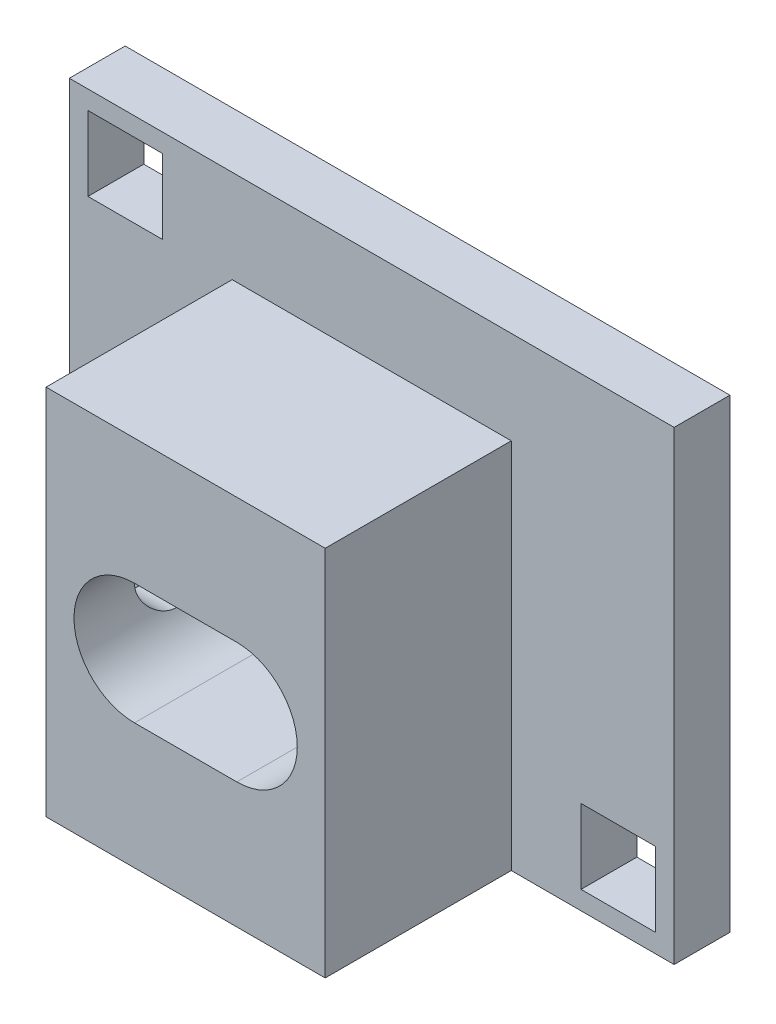
from build123d import *

# Parameters (mm, degrees)
SKETCH_1_W               = 65
SKETCH_1_H               = 50
EXTRUDE_1_DEPTH          = 6
SKETCH_2_W               = 8
SKETCH_2_H               = 8
CUT_EXTRUDE_1_DEPTH      = 42.43971525
SKETCH_3_W               = 30
SKETCH_3_H               = 40
EXTRUDE_2_DEPTH          = 20
CUT_EXTRUDE_2_DEPTH      = 20
CUT_EXTRUDE_3_REACH      = 61.643
CUT_EXTRUDE_3_END_RADIUS = 6.5
SKETCH_5_R               = 3.5


with BuildPart() as part:
    # Эскиз1 → Бобышка-Вытянуть1 (new body)
    with BuildSketch(Plane.XY):
        Rectangle(SKETCH_1_W, SKETCH_1_H)
    extrude(amount=EXTRUDE_1_DEPTH)

    # Эскиз2 → Вырез-Вытянуть1 (cut, through all)
    with BuildSketch(Plane.XY.offset(6)):
        with Locations((-26.5, 19)):
            Rectangle(SKETCH_2_W, SKETCH_2_H)
        with Locations((26.5, -19)):
            Rectangle(SKETCH_2_W, SKETCH_2_H)
    extrude(amount=-CUT_EXTRUDE_1_DEPTH, mode=Mode.SUBTRACT)

    # Эскиз3 → Бобышка-Вытянуть2 (add)
    with BuildSketch(Plane.XY.offset(6)):
        with Locations((0, -5)):
            Rectangle(SKETCH_3_W, SKETCH_3_H)
    extrude(amount=EXTRUDE_2_DEPTH)

    # Эскиз4 → Вырез-Вытянуть2 (cut)
    with BuildSketch(Plane.XY.offset(26)):
        with BuildLine():
            Line((-5.5, 1.5), (5.5, 1.5))
            ThreePointArc((5.5, 1.5), (12, -5), (5.5, -11.5))
            Line((5.5, -11.5), (-5.5, -11.5))
            ThreePointArc((-5.5, -11.5), (-12, -5), (-5.5, 1.5))
        make_face()
    extrude(amount=-CUT_EXTRUDE_2_DEPTH, mode=Mode.SUBTRACT)

    # Вырез-Вытянуть3: up to this cylinder (the profile starts outside it)
    cut_extrude_3_end = Plane(origin=(-5.5, -5, 16), z_dir=(0, 0, 1)) * Cylinder(CUT_EXTRUDE_3_END_RADIUS, 137.286, mode=Mode.PRIVATE)
    # Эскиз5 → Вырез-Вытянуть3 (cut, up to the surface)
    with BuildSketch(Plane.ZY.offset(15), mode=Mode.PRIVATE) as cut_extrude_3_sk1:
        with Locations(Location((16, -5, 0), (0, 0, 270))):
            Circle(SKETCH_5_R)
    cut_extrude_3_tool1 = extrude(cut_extrude_3_sk1.sketch, amount=-CUT_EXTRUDE_3_REACH, mode=Mode.PRIVATE) - cut_extrude_3_end
    add(cut_extrude_3_tool1.solids().sort_by_distance((-15, -5, 16))[0], mode=Mode.SUBTRACT)


solid = part.part
